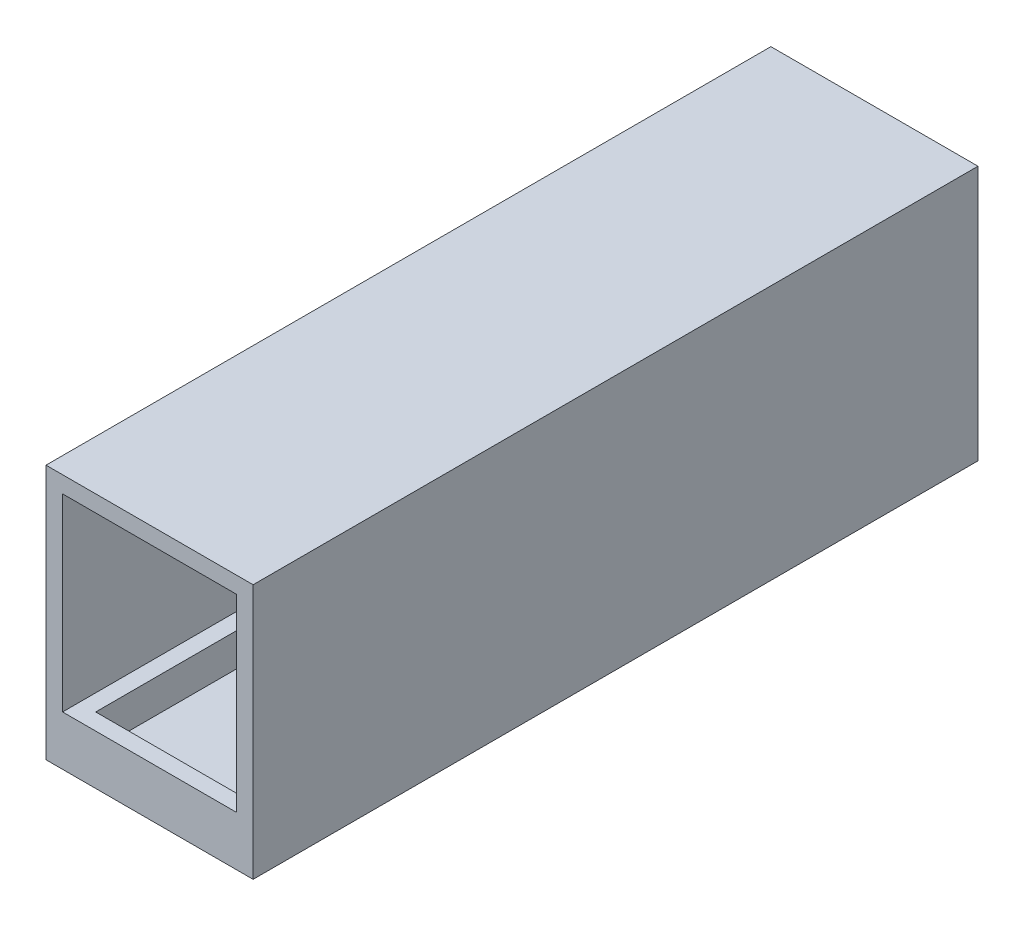
from build123d import *

# Parameters (mm, degrees)
SKETCH1_W           = 53.975
SKETCH1_H           = 165.1
SKETCH1_H_2         = 93.6625
BOSS_EXTRUDE4_DEPTH = 12.7
SKETCH4_W           = 66.675
SKETCH4_H           = 6.35
BOSS_EXTRUDE5_DEPTH = 277.8125
BOSS_EXTRUDE6_DEPTH = 277.8125
SKETCH6_R           = 3.175
CUT_EXTRUDE3_DEPTH  = 6.35


with BuildPart() as part:
    # Sketch1 → Boss-Extrude4 (new body)
    with BuildSketch(Plane(origin=(0, 0, 0), x_dir=(1, 0, 0), z_dir=(0, 1, 0))):
        Polygon((33.3375, -88.9), (33.3375, 88.9), (33.3375, 188.9125), (-33.3375, 188.9125), (-33.3375, 88.9), (-33.3375, -88.9), align=None)
        Rectangle(SKETCH1_W, SKETCH1_H, mode=Mode.SUBTRACT)
        with Locations((0, 135.73125)):
            Rectangle(SKETCH1_W, SKETCH1_H_2, mode=Mode.SUBTRACT)
    extrude(amount=BOSS_EXTRUDE4_DEPTH)

    # Sketch4 → Boss-Extrude5 (add)
    with BuildSketch(Plane.XY.offset(88.9)):
        with Locations((0, -3.175)):
            Rectangle(SKETCH4_W, SKETCH4_H)
    extrude(amount=-BOSS_EXTRUDE5_DEPTH)

    # Sketch5 → Boss-Extrude6 (add)
    with BuildSketch(Plane.XY.offset(88.9)):
        Polygon((-39.6875, -6.35), (-39.6875, 91.44), (39.6875, 91.44), (39.6875, -6.35), (33.3375, -6.35), (33.3375, 85.09), (-33.3375, 85.09), (-33.3375, -6.35), align=None)
    extrude(amount=-BOSS_EXTRUDE6_DEPTH)

    # Sketch6 → Cut-Extrude3 (cut)
    with BuildSketch(Plane.XZ.offset(6.35)):
        with Locations(Location((-33.3375, -182.5625, 0), (0, 0, 270))):
            Circle(SKETCH6_R)
        with Locations(Location((33.3375, -182.5625, 0), (0, 0, 90))):
            Circle(SKETCH6_R)
    extrude(amount=-CUT_EXTRUDE3_DEPTH, mode=Mode.SUBTRACT)


solid = part.part
